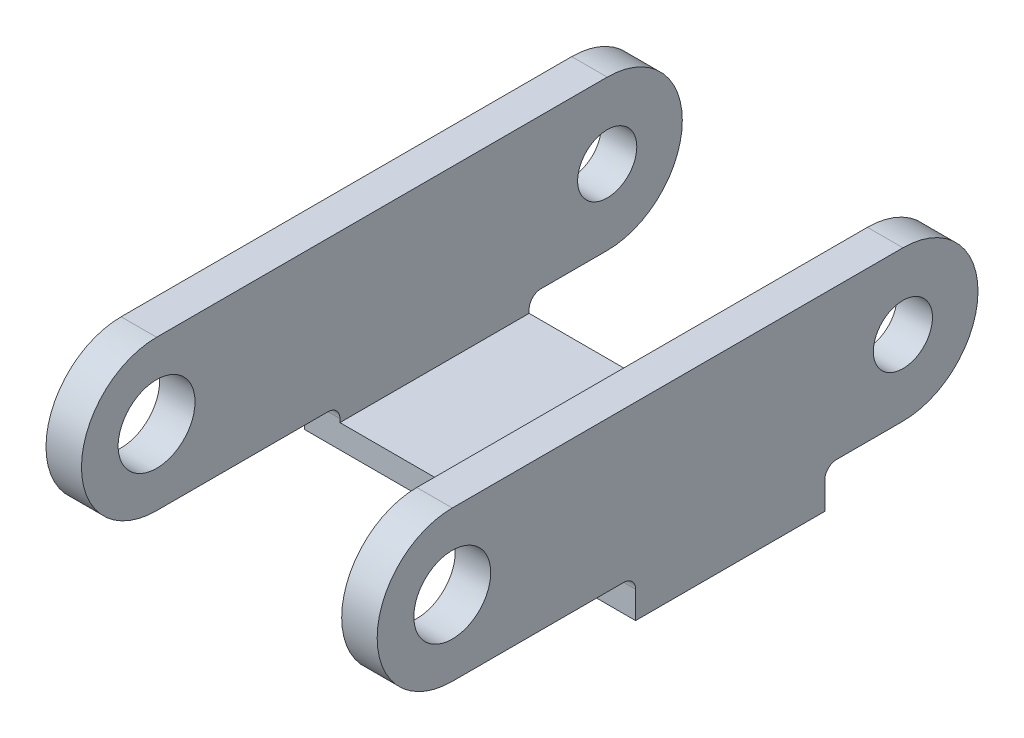
from build123d import *

# Parameters (mm, degrees)
SKETCH1_R           = 3.25
SKETCH1_R_2         = 2.5
BOSS_EXTRUDE1_DEPTH = 3
BOSS_EXTRUDE2_START = -9.65
SKETCH2_W           = 11
SKETCH2_H           = 16
BOSS_EXTRUDE2_DEPTH = 2


with BuildPart() as part:
    # Sketch1 → Boss-Extrude1 (new body)
    with BuildSketch(Plane(origin=(0, 0, 0), x_dir=(0, 0, -1), z_dir=(1, 0, 0))):
        with BuildLine():
            Line((0, 6.35), (38.1, 6.35))
            ThreePointArc((38.1, 6.35), (44.45, 0), (38.1, -6.35))
            Line((38.1, -6.35), (32.5, -6.35))
            ThreePointArc((32.5, -6.35), (31.792893219, -6.642893219), (31.5, -7.35))
            Line((31.5, -7.35), (31.5, -9.65))
            Line((31.5, -9.65), (15.5, -9.65))
            Line((15.5, -9.65), (15.5, -7.35))
            ThreePointArc((15.5, -7.35), (15.207106781, -6.642893219), (14.5, -6.35))
            Line((14.5, -6.35), (0, -6.35))
            ThreePointArc((0, -6.35), (-6.35, 0), (0, 6.35))
        make_face()
        Circle(SKETCH1_R, mode=Mode.SUBTRACT)
        with Locations((38.1, 0)):
            Circle(SKETCH1_R_2, mode=Mode.SUBTRACT)
    extrude(amount=BOSS_EXTRUDE1_DEPTH)

    # Sketch2 → Boss-Extrude2 (add)
    with BuildSketch(Plane(origin=(0, 0, 0), x_dir=(1, 0, 0), z_dir=(0, 1, 0)).offset(BOSS_EXTRUDE2_START)):
        with Locations((8.5, 23.5)):
            Rectangle(SKETCH2_W, SKETCH2_H)
    extrude(amount=BOSS_EXTRUDE2_DEPTH)

    # Mirror2: part across plane


with BuildPart() as part_1:
    add(part.part)
    add(part.part.mirror(Plane(origin=(14, 0, 0), x_dir=(0, 0, 1), z_dir=(1, 0, 0))))


solid = part_1.part
